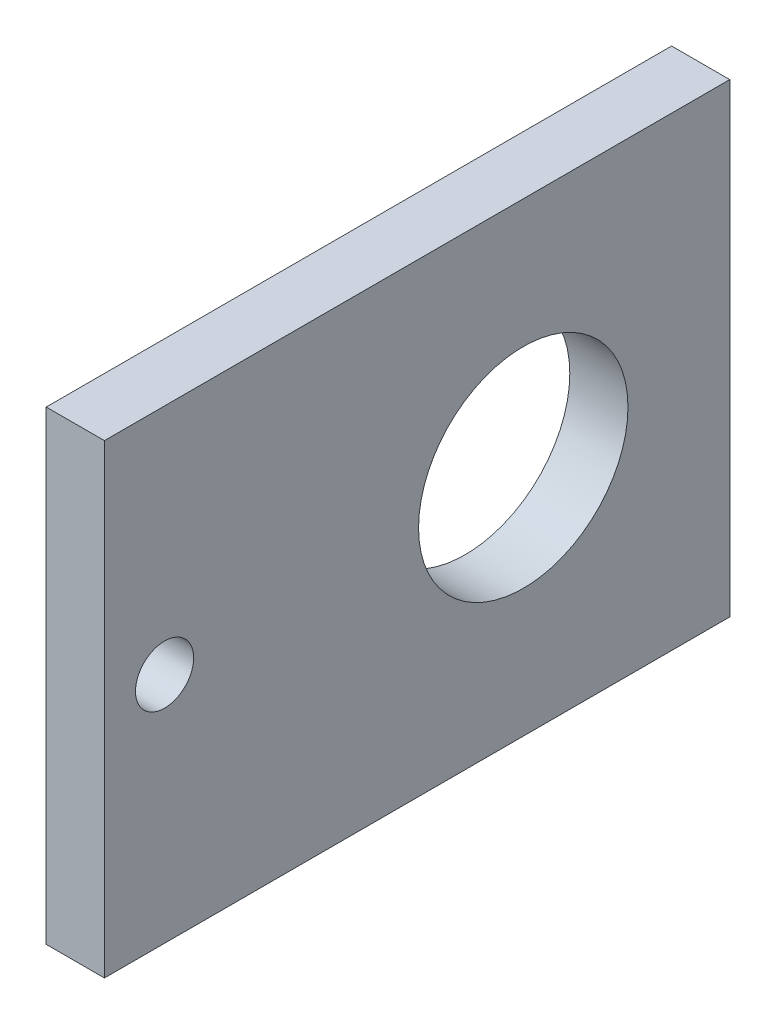
from build123d import *

# Parameters (mm, degrees)
SKETCH1_W           = 53.747195152
SKETCH1_H           = 40
SKETCH1_R           = 9
SKETCH1_R_2         = 2.5
BOSS_EXTRUDE1_DEPTH = 5


with BuildPart() as part:
    # Sketch1 → Boss-Extrude1 (new body)
    with BuildSketch(Plane(origin=(0, 0, 0), x_dir=(0, 0, -1), z_dir=(1, 0, 0))):
        with Locations((26.873597576, -20)):
            Rectangle(SKETCH1_W, SKETCH1_H)
        with Locations((36, -20)):
            Circle(SKETCH1_R, mode=Mode.SUBTRACT)
        with Locations((5.169067962, -20)):
            Circle(SKETCH1_R_2, mode=Mode.SUBTRACT)
    extrude(amount=BOSS_EXTRUDE1_DEPTH)


solid = part.part
